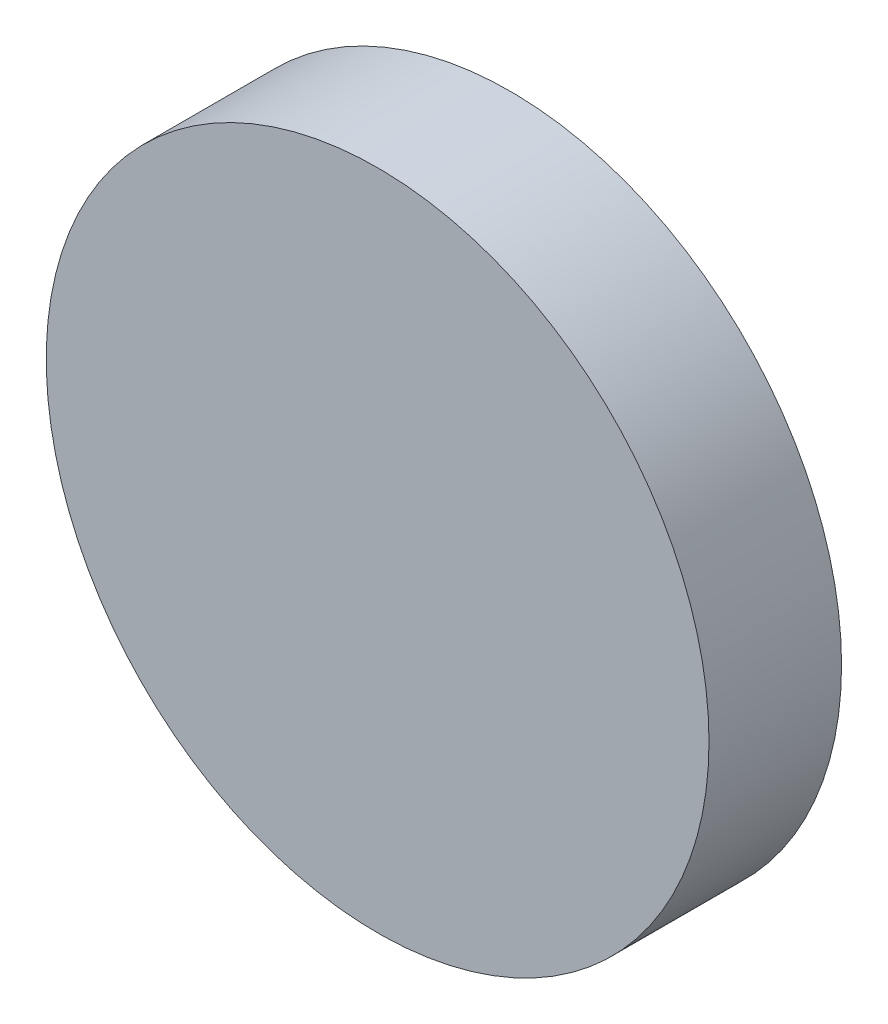
from build123d import *

# Parameters (mm, degrees)
SKETCH1_R           = 50
BOSS_EXTRUDE1_DEPTH = 20


with BuildPart() as part:
    # Sketch1 → Boss-Extrude1 (new body)
    with BuildSketch(Plane.XY):
        Circle(SKETCH1_R)
    extrude(amount=BOSS_EXTRUDE1_DEPTH)


solid = part.part
